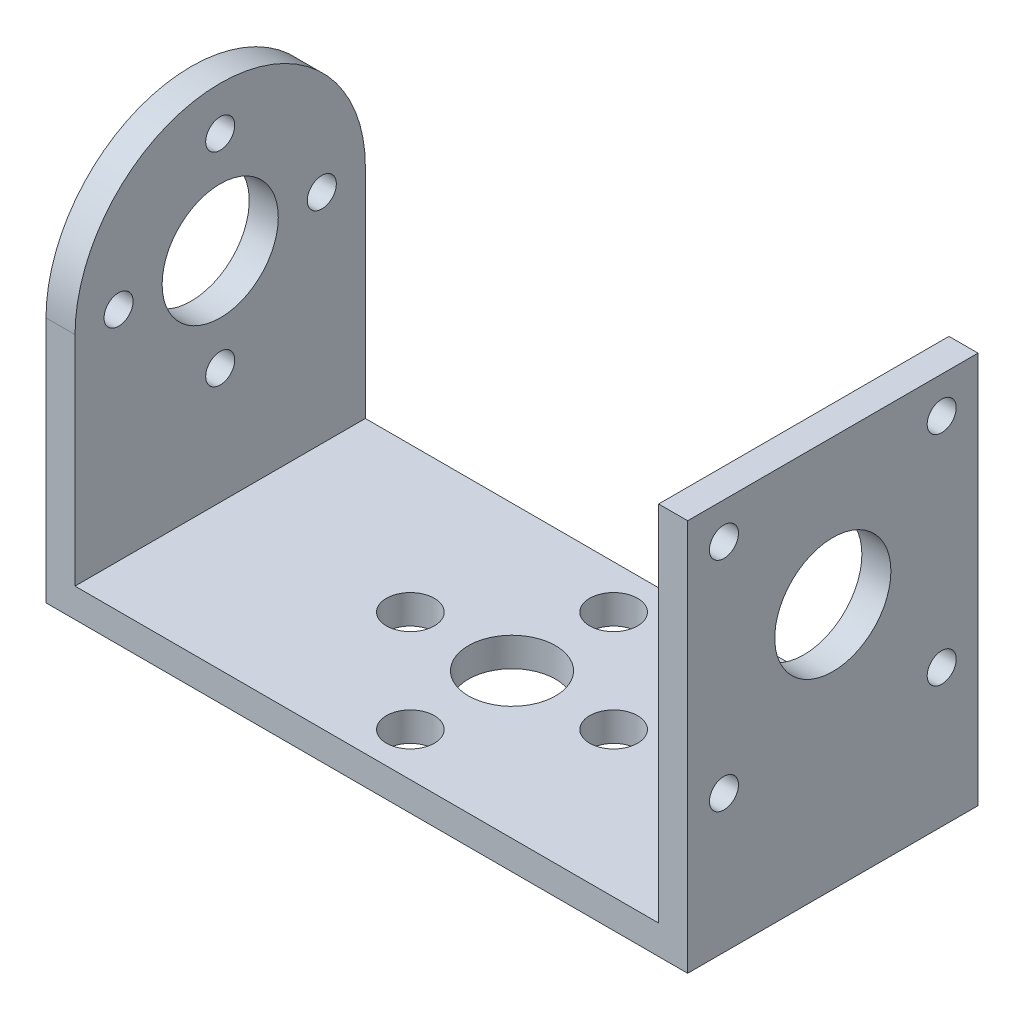
from build123d import *

# Parameters (mm, degrees)
SKETCH_1_W          = 44.2
SKETCH_1_H          = 20
EXTRUDE_1_DEPTH     = 2
CUT_EXTRUDE_1_REACH = 26.339
SKETCH_2_R          = 3
SKETCH_2_R_2        = 1.65
SKETCH_3_W          = 20
SKETCH_3_H          = 25
EXTRUDE_2_DEPTH     = 2
CUT_EXTRUDE_2_REACH = 54.751
SKETCH_4_R          = 1
CUT_EXTRUDE_3_REACH = 54.751
SKETCH_5_R          = 4
SKETCH_5_R_2        = 1


with BuildPart() as part:
    # 草图1 → 凸台-拉伸1 (new body)
    with BuildSketch(Plane(origin=(0, 0, 0), x_dir=(1, 0, 0), z_dir=(0, 1, 0))):
        Rectangle(SKETCH_1_W, SKETCH_1_H)
    extrude(amount=EXTRUDE_1_DEPTH)

    # 草图2 → 切除-拉伸1 (cut, up to next)
    with BuildSketch(Plane(origin=(0, 2, 0), x_dir=(1, 0, 0), z_dir=(0, 1, 0)), mode=Mode.PRIVATE) as cut_extrude_1_sk1:
        with Locations(Location((0, 0, 0), (0, 0, 270))):
            Circle(SKETCH_2_R)
    cut_extrude_1_tool1 = extrude(cut_extrude_1_sk1.sketch, amount=-CUT_EXTRUDE_1_REACH, mode=Mode.PRIVATE) & part.part
    # 草图2 → 切除-拉伸1 (cut, up to next)
    with BuildSketch(Plane(origin=(0, 2, 0), x_dir=(1, 0, 0), z_dir=(0, 1, 0)), mode=Mode.PRIVATE) as cut_extrude_1_sk2:
        with Locations(Location((0, 7, 0), (0, 0, 270))):
            Circle(SKETCH_2_R_2)
    cut_extrude_1_tool2 = extrude(cut_extrude_1_sk2.sketch, amount=-CUT_EXTRUDE_1_REACH, mode=Mode.PRIVATE) & part.part
    # 草图2 → 切除-拉伸1 (cut, up to next)
    with BuildSketch(Plane(origin=(0, 2, 0), x_dir=(1, 0, 0), z_dir=(0, 1, 0)), mode=Mode.PRIVATE) as cut_extrude_1_sk3:
        with Locations(Location((7, 0, 0), (0, 0, 270))):
            Circle(SKETCH_2_R_2)
    cut_extrude_1_tool3 = extrude(cut_extrude_1_sk3.sketch, amount=-CUT_EXTRUDE_1_REACH, mode=Mode.PRIVATE) & part.part
    # 草图2 → 切除-拉伸1 (cut, up to next)
    with BuildSketch(Plane(origin=(0, 2, 0), x_dir=(1, 0, 0), z_dir=(0, 1, 0)), mode=Mode.PRIVATE) as cut_extrude_1_sk4:
        with Locations(Location((0, -7, 0), (0, 0, 270))):
            Circle(SKETCH_2_R_2)
    cut_extrude_1_tool4 = extrude(cut_extrude_1_sk4.sketch, amount=-CUT_EXTRUDE_1_REACH, mode=Mode.PRIVATE) & part.part
    # 草图2 → 切除-拉伸1 (cut, up to next)
    with BuildSketch(Plane(origin=(0, 2, 0), x_dir=(1, 0, 0), z_dir=(0, 1, 0)), mode=Mode.PRIVATE) as cut_extrude_1_sk5:
        with Locations(Location((-7, 0, 0), (0, 0, 270))):
            Circle(SKETCH_2_R_2)
    cut_extrude_1_tool5 = extrude(cut_extrude_1_sk5.sketch, amount=-CUT_EXTRUDE_1_REACH, mode=Mode.PRIVATE) & part.part
    add(cut_extrude_1_tool1.solids().sort_by_distance((0, 2, 0))[0], mode=Mode.SUBTRACT)
    add(cut_extrude_1_tool2.solids().sort_by_distance((0, 2, -7))[0], mode=Mode.SUBTRACT)
    add(cut_extrude_1_tool3.solids().sort_by_distance((7, 2, 0))[0], mode=Mode.SUBTRACT)
    add(cut_extrude_1_tool4.solids().sort_by_distance((0, 2, 7))[0], mode=Mode.SUBTRACT)
    add(cut_extrude_1_tool5.solids().sort_by_distance((-7, 2, 0))[0], mode=Mode.SUBTRACT)

    # 草图3 → 凸台-拉伸2 (add)
    with BuildSketch(Plane.ZY.offset(22.1)):
        with Locations((0, 14.5)):
            Rectangle(SKETCH_3_W, SKETCH_3_H)
    extrude_2 = extrude(amount=-EXTRUDE_2_DEPTH)

    # 镜向2: 凸台-拉伸2 across plane
    add(extrude_2.mirror(Plane.ZY))

    # 草图4 → 切除-拉伸2 (cut, up to next)
    with BuildSketch(Plane.ZY.offset(22.1), mode=Mode.PRIVATE) as cut_extrude_2_sk1:
        with BuildLine():
            ThreePointArc((-10, 17), (-7.071067812, 24.071067812), (0, 27))
            Line((0, 27), (-10, 27))
            Line((-10, 27), (-10, 17))
        make_face()
    cut_extrude_2_tool1 = extrude(cut_extrude_2_sk1.sketch, amount=-CUT_EXTRUDE_2_REACH, mode=Mode.PRIVATE) & part.part
    # 草图4 → 切除-拉伸2 (cut, up to next)
    with BuildSketch(Plane.ZY.offset(22.1), mode=Mode.PRIVATE) as cut_extrude_2_sk2:
        with BuildLine():
            Line((10, 27), (0, 27))
            ThreePointArc((0, 27), (7.071067812, 24.071067812), (10, 17))
            Line((10, 17), (10, 27))
        make_face()
    cut_extrude_2_tool2 = extrude(cut_extrude_2_sk2.sketch, amount=-CUT_EXTRUDE_2_REACH, mode=Mode.PRIVATE) & part.part
    # 草图4 → 切除-拉伸2 (cut, up to next)
    with BuildSketch(Plane.ZY.offset(22.1), mode=Mode.PRIVATE) as cut_extrude_2_sk3:
        with BuildLine():
            ThreePointArc((1, 10), (0.707106781, 10.707106781), (0, 11))
            Line((0, 11), (0, 9))
            ThreePointArc((0, 9), (0.707106781, 9.292893219), (1, 10))
        make_face()
    cut_extrude_2_tool3 = extrude(cut_extrude_2_sk3.sketch, amount=-CUT_EXTRUDE_2_REACH, mode=Mode.PRIVATE) & part.part
    # 草图4 → 切除-拉伸2 (cut, up to next)
    with BuildSketch(Plane.ZY.offset(22.1), mode=Mode.PRIVATE) as cut_extrude_2_sk4:
        with BuildLine():
            Line((0, 9), (0, 11))
            ThreePointArc((0, 11), (-1, 10), (0, 9))
        make_face()
    cut_extrude_2_tool4 = extrude(cut_extrude_2_sk4.sketch, amount=-CUT_EXTRUDE_2_REACH, mode=Mode.PRIVATE) & part.part
    # 草图4 → 切除-拉伸2 (cut, up to next)
    with BuildSketch(Plane.ZY.offset(22.1), mode=Mode.PRIVATE) as cut_extrude_2_sk5:
        with BuildLine():
            ThreePointArc((1, 10), (0.707106781, 10.707106781), (0, 11))
            Line((0, 11), (0, 9))
            ThreePointArc((0, 9), (0.707106781, 9.292893219), (1, 10))
        make_face()
    cut_extrude_2_tool5 = extrude(cut_extrude_2_sk5.sketch, amount=-CUT_EXTRUDE_2_REACH, mode=Mode.PRIVATE) & part.part
    # 草图4 → 切除-拉伸2 (cut, up to next)
    with BuildSketch(Plane.ZY.offset(22.1), mode=Mode.PRIVATE) as cut_extrude_2_sk6:
        with BuildLine():
            Line((0, 9), (0, 11))
            ThreePointArc((0, 11), (-1, 10), (0, 9))
        make_face()
    cut_extrude_2_tool6 = extrude(cut_extrude_2_sk6.sketch, amount=-CUT_EXTRUDE_2_REACH, mode=Mode.PRIVATE) & part.part
    # 草图4 → 切除-拉伸2 (cut, up to next)
    with BuildSketch(Plane.ZY.offset(22.1), mode=Mode.PRIVATE) as cut_extrude_2_sk7:
        with BuildLine():
            ThreePointArc((4, 17), (2.828427125, 19.828427125), (0, 21))
            Line((0, 21), (0, 13))
            ThreePointArc((0, 13), (2.828427125, 14.171572875), (4, 17))
        make_face()
    cut_extrude_2_tool7 = extrude(cut_extrude_2_sk7.sketch, amount=-CUT_EXTRUDE_2_REACH, mode=Mode.PRIVATE) & part.part
    # 草图4 → 切除-拉伸2 (cut, up to next)
    with BuildSketch(Plane.ZY.offset(22.1), mode=Mode.PRIVATE) as cut_extrude_2_sk8:
        with BuildLine():
            Line((0, 13), (0, 21))
            ThreePointArc((0, 21), (-4, 17), (0, 13))
        make_face()
    cut_extrude_2_tool8 = extrude(cut_extrude_2_sk8.sketch, amount=-CUT_EXTRUDE_2_REACH, mode=Mode.PRIVATE) & part.part
    # 草图4 → 切除-拉伸2 (cut, up to next)
    with BuildSketch(Plane.ZY.offset(22.1), mode=Mode.PRIVATE) as cut_extrude_2_sk9:
        with BuildLine():
            ThreePointArc((4, 17), (2.828427125, 19.828427125), (0, 21))
            Line((0, 21), (0, 13))
            ThreePointArc((0, 13), (2.828427125, 14.171572875), (4, 17))
        make_face()
    cut_extrude_2_tool9 = extrude(cut_extrude_2_sk9.sketch, amount=-CUT_EXTRUDE_2_REACH, mode=Mode.PRIVATE) & part.part
    # 草图4 → 切除-拉伸2 (cut, up to next)
    with BuildSketch(Plane.ZY.offset(22.1), mode=Mode.PRIVATE) as cut_extrude_2_sk10:
        with BuildLine():
            Line((0, 13), (0, 21))
            ThreePointArc((0, 21), (-4, 17), (0, 13))
        make_face()
    cut_extrude_2_tool10 = extrude(cut_extrude_2_sk10.sketch, amount=-CUT_EXTRUDE_2_REACH, mode=Mode.PRIVATE) & part.part
    # 草图4 → 切除-拉伸2 (cut, up to next)
    with BuildSketch(Plane.ZY.offset(22.1), mode=Mode.PRIVATE) as cut_extrude_2_sk11:
        with Locations((7, 17)):
            Circle(SKETCH_4_R)
    cut_extrude_2_tool11 = extrude(cut_extrude_2_sk11.sketch, amount=-CUT_EXTRUDE_2_REACH, mode=Mode.PRIVATE) & part.part
    # 草图4 → 切除-拉伸2 (cut, up to next)
    with BuildSketch(Plane.ZY.offset(22.1), mode=Mode.PRIVATE) as cut_extrude_2_sk12:
        with Locations((0, 24)):
            Circle(SKETCH_4_R)
    cut_extrude_2_tool12 = extrude(cut_extrude_2_sk12.sketch, amount=-CUT_EXTRUDE_2_REACH, mode=Mode.PRIVATE) & part.part
    # 草图4 → 切除-拉伸2 (cut, up to next)
    with BuildSketch(Plane.ZY.offset(22.1), mode=Mode.PRIVATE) as cut_extrude_2_sk13:
        with Locations((-7, 17)):
            Circle(SKETCH_4_R)
    cut_extrude_2_tool13 = extrude(cut_extrude_2_sk13.sketch, amount=-CUT_EXTRUDE_2_REACH, mode=Mode.PRIVATE) & part.part
    add(cut_extrude_2_tool1.solids().sort_by_distance((-22.1, 24.766321, -7.766321))[0], mode=Mode.SUBTRACT)
    add(cut_extrude_2_tool2.solids().sort_by_distance((-22.1, 24.766321, 7.766321))[0], mode=Mode.SUBTRACT)
    add(cut_extrude_2_tool3.solids().sort_by_distance((-22.1, 10, 0.424413))[0], mode=Mode.SUBTRACT)
    add(cut_extrude_2_tool4.solids().sort_by_distance((-22.1, 10, -0.424413))[0], mode=Mode.SUBTRACT)
    add(cut_extrude_2_tool5.solids().sort_by_distance((-22.1, 10, 0.424413))[0], mode=Mode.SUBTRACT)
    add(cut_extrude_2_tool6.solids().sort_by_distance((-22.1, 10, -0.424413))[0], mode=Mode.SUBTRACT)
    add(cut_extrude_2_tool7.solids().sort_by_distance((-22.1, 17, 1.697653))[0], mode=Mode.SUBTRACT)
    add(cut_extrude_2_tool8.solids().sort_by_distance((-22.1, 17, -1.697653))[0], mode=Mode.SUBTRACT)
    add(cut_extrude_2_tool9.solids().sort_by_distance((-22.1, 17, 1.697653))[0], mode=Mode.SUBTRACT)
    add(cut_extrude_2_tool10.solids().sort_by_distance((-22.1, 17, -1.697653))[0], mode=Mode.SUBTRACT)
    add(cut_extrude_2_tool11.solids().sort_by_distance((-22.1, 17, 7))[0], mode=Mode.SUBTRACT)
    add(cut_extrude_2_tool12.solids().sort_by_distance((-22.1, 24, 0))[0], mode=Mode.SUBTRACT)
    add(cut_extrude_2_tool13.solids().sort_by_distance((-22.1, 17, -7))[0], mode=Mode.SUBTRACT)

    # 草图5 → 切除-拉伸3 (cut, up to next)
    with BuildSketch(Plane(origin=(22.1, 0, 0), x_dir=(0, 0, -1), z_dir=(1, 0, 0)), mode=Mode.PRIVATE) as cut_extrude_3_sk1:
        with Locations(Location((0, 17, 0), (0, 0, 180))):
            Circle(SKETCH_5_R)
    cut_extrude_3_tool1 = extrude(cut_extrude_3_sk1.sketch, amount=-CUT_EXTRUDE_3_REACH, mode=Mode.PRIVATE) & part.part
    # 草图5 → 切除-拉伸3 (cut, up to next)
    with BuildSketch(Plane(origin=(22.1, 0, 0), x_dir=(0, 0, -1), z_dir=(1, 0, 0)), mode=Mode.PRIVATE) as cut_extrude_3_sk2:
        with Locations((-7.5, 24.5)):
            Circle(SKETCH_5_R_2)
    cut_extrude_3_tool2 = extrude(cut_extrude_3_sk2.sketch, amount=-CUT_EXTRUDE_3_REACH, mode=Mode.PRIVATE) & part.part
    # 草图5 → 切除-拉伸3 (cut, up to next)
    with BuildSketch(Plane(origin=(22.1, 0, 0), x_dir=(0, 0, -1), z_dir=(1, 0, 0)), mode=Mode.PRIVATE) as cut_extrude_3_sk3:
        with Locations((7.5, 24.5)):
            Circle(SKETCH_5_R_2)
    cut_extrude_3_tool3 = extrude(cut_extrude_3_sk3.sketch, amount=-CUT_EXTRUDE_3_REACH, mode=Mode.PRIVATE) & part.part
    # 草图5 → 切除-拉伸3 (cut, up to next)
    with BuildSketch(Plane(origin=(22.1, 0, 0), x_dir=(0, 0, -1), z_dir=(1, 0, 0)), mode=Mode.PRIVATE) as cut_extrude_3_sk4:
        with Locations((7.5, 9.5)):
            Circle(SKETCH_5_R_2)
    cut_extrude_3_tool4 = extrude(cut_extrude_3_sk4.sketch, amount=-CUT_EXTRUDE_3_REACH, mode=Mode.PRIVATE) & part.part
    # 草图5 → 切除-拉伸3 (cut, up to next)
    with BuildSketch(Plane(origin=(22.1, 0, 0), x_dir=(0, 0, -1), z_dir=(1, 0, 0)), mode=Mode.PRIVATE) as cut_extrude_3_sk5:
        with Locations((-7.5, 9.5)):
            Circle(SKETCH_5_R_2)
    cut_extrude_3_tool5 = extrude(cut_extrude_3_sk5.sketch, amount=-CUT_EXTRUDE_3_REACH, mode=Mode.PRIVATE) & part.part
    add(cut_extrude_3_tool1.solids().sort_by_distance((22.1, 17, 0))[0], mode=Mode.SUBTRACT)
    add(cut_extrude_3_tool2.solids().sort_by_distance((22.1, 24.5, 7.5))[0], mode=Mode.SUBTRACT)
    add(cut_extrude_3_tool3.solids().sort_by_distance((22.1, 24.5, -7.5))[0], mode=Mode.SUBTRACT)
    add(cut_extrude_3_tool4.solids().sort_by_distance((22.1, 9.5, -7.5))[0], mode=Mode.SUBTRACT)
    add(cut_extrude_3_tool5.solids().sort_by_distance((22.1, 9.5, 7.5))[0], mode=Mode.SUBTRACT)


solid = part.part
